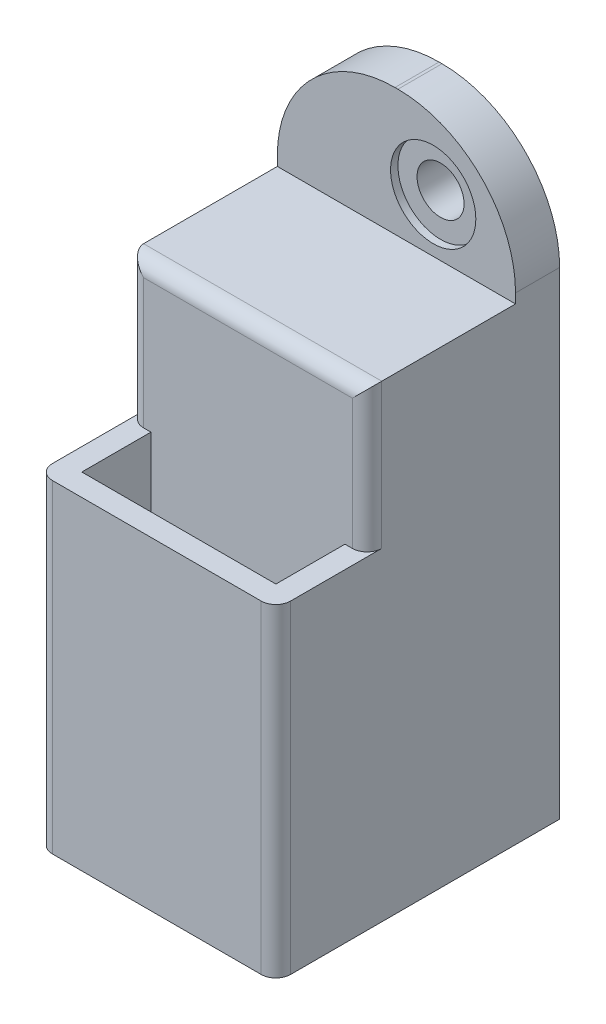
from build123d import *

# Parameters (mm, degrees)
CROQUIS2_W               = 16.2
CROQUIS2_H               = 9.2
CROQUIS2_W_2             = 13.2
CROQUIS2_H_2             = 6.2
SALIENTE_EXTRUIR1_DEPTH  = 6.5
CROQUIS3_W               = 16.2
CROQUIS3_H               = 12
SALIENTE_EXTRUIR2_DEPTH  = 2
SALIENTE_EXTRUIR3_DEPTH  = 8.1
CROQUIS5_W               = 16.2
CROQUIS5_H               = 3
SALIENTE_EXTRUIR4_DEPTH  = 13
CROQUIS6_R               = 1.6
CORTAR_EXTRUIR1_DEPTH    = 3
CROQUIS7_W               = 16.2
CROQUIS7_H               = 2
SALIENTE_EXTRUIR5_DEPTH  = 3
CROQUIS8_R               = 2.9
CORTAR_EXTRUIR2_DEPTH    = 0.5
REDONDEO1_R              = 1
REDONDEO6_R              = 8
CROQUIS9_W               = 13.2
CROQUIS9_H               = 6.2
SALIENTE_EXTRUIR6_DEPTH  = 3.5
CROQUIS10_W              = 13.2
CROQUIS10_H              = 1.5
SALIENTE_EXTRUIR7_DEPTH  = 3.5
CROQUIS11_W              = 13.2
CROQUIS11_H              = 6.2
SALIENTE_EXTRUIR8_DEPTH  = 12
CROQUIS12_W              = 13.2
CROQUIS12_H              = 1.5
SALIENTE_EXTRUIR9_DEPTH  = 12
CROQUIS13_W              = 16.2
CROQUIS13_H              = 7.85
SALIENTE_EXTRUIR10_DEPTH = 10.1
CROQUIS14_W              = 12.6
CROQUIS14_H              = 6.5
CORTAR_EXTRUIR3_DEPTH    = 8.1
REDONDEO7_R              = 1


with BuildPart() as part:
    # Croquis2 → Saliente-Extruir1 (new body)
    with BuildSketch(Plane(origin=(0, 0, 0), x_dir=(1, 0, 0), z_dir=(0, 1, 0))):
        with Locations((6.6, -3.1)):
            Rectangle(CROQUIS2_W, CROQUIS2_H)
        with Locations((6.6, -3.1)):
            Rectangle(CROQUIS2_W_2, CROQUIS2_H_2, mode=Mode.SUBTRACT)
    extrude(amount=SALIENTE_EXTRUIR1_DEPTH)

    # Croquis3 → Saliente-Extruir2 (add)
    with BuildSketch(Plane(origin=(0, 0, -1.5), x_dir=(-1, 0, 0), z_dir=(0, 0, -1))):
        with Locations((-6.6, 6)):
            Rectangle(CROQUIS3_W, CROQUIS3_H)
    extrude(amount=SALIENTE_EXTRUIR2_DEPTH)

    # Croquis4 → Saliente-Extruir3 (add)
    with BuildSketch(Plane(origin=(0, 0, -3.5), x_dir=(-1, 0, 0), z_dir=(0, 0, -1))):
        Polygon((1.5, 0), (1.5, 12), (-14.7, 12), (-14.7, 0), (-12.9, 0), (-12.9, 11), (-0.3, 11), (-0.3, 0), align=None)
    extrude(amount=SALIENTE_EXTRUIR3_DEPTH)

    # Croquis5 → Saliente-Extruir4 (add)
    with BuildSketch(Plane(origin=(0, 12, 0), x_dir=(1, 0, 0), z_dir=(0, 1, 0))):
        with Locations((6.6, 10.1)):
            Rectangle(CROQUIS5_W, CROQUIS5_H)
    extrude(amount=SALIENTE_EXTRUIR4_DEPTH)

    # Croquis6 → Cortar-Extruir1 (cut)
    with BuildSketch(Plane.XY.offset(-8.6)):
        with Locations((9.1, 20)):
            Circle(CROQUIS6_R)
    extrude(amount=-CORTAR_EXTRUIR1_DEPTH, mode=Mode.SUBTRACT)

    # Croquis7 → Saliente-Extruir5 (add)
    with BuildSketch(Plane.XY.offset(-1.5)):
        with Locations((6.6, 7.5)):
            Rectangle(CROQUIS7_W, CROQUIS7_H)
    extrude(amount=SALIENTE_EXTRUIR5_DEPTH)

    # Croquis8 → Cortar-Extruir2 (cut)
    with BuildSketch(Plane.XY.offset(-8.6)):
        with Locations((9.1, 20)):
            Circle(CROQUIS8_R)
    extrude(amount=-CORTAR_EXTRUIR2_DEPTH, mode=Mode.SUBTRACT)

    # Redondeo1
    redondeo1_edges = [part.edges().sort_by_distance(p)[0] for p in [
        (14.7, 3.25, 7.7),
        (-1.5, 3.25, 7.7),
    ]]
    fillet(redondeo1_edges, radius=REDONDEO1_R)

    # Redondeo6
    redondeo6_edges = [part.edges().sort_by_distance(p)[0] for p in [
        (14.7, 25, -10.1),
        (-1.5, 25, -10.1),
    ]]
    fillet(redondeo6_edges, radius=REDONDEO6_R)

    # Croquis9 → Saliente-Extruir6 (add)
    with BuildSketch(Plane.XZ):
        with BuildLine():
            Line((13.7, 7.7), (-0.5, 7.7))
            ThreePointArc((-0.5, 7.7), (-1.207106781, 7.407106781), (-1.5, 6.7))
            Line((-1.5, 6.7), (-1.5, -11.6))
            Line((-1.5, -11.6), (0.3, -11.6))
            Line((0.3, -11.6), (0.3, -3.5))
            Line((0.3, -3.5), (12.9, -3.5))
            Line((12.9, -3.5), (12.9, -11.6))
            Line((12.9, -11.6), (14.7, -11.6))
            Line((14.7, -11.6), (14.7, 6.7))
            ThreePointArc((14.7, 6.7), (14.407106781, 7.407106781), (13.7, 7.7))
        make_face()
        with Locations((6.6, 3.1)):
            Rectangle(CROQUIS9_W, CROQUIS9_H, mode=Mode.SUBTRACT)
    extrude(amount=SALIENTE_EXTRUIR6_DEPTH)

    # Croquis10 → Saliente-Extruir7 (add)
    with BuildSketch(Plane.XZ.offset(-6.5)):
        with Locations((6.6, 0.75)):
            Rectangle(CROQUIS10_W, CROQUIS10_H)
    extrude(amount=SALIENTE_EXTRUIR7_DEPTH)

    # Croquis11 → Saliente-Extruir8 (add)
    with BuildSketch(Plane.XZ.offset(3.5)):
        with BuildLine():
            Line((13.7, 7.7), (-0.5, 7.7))
            ThreePointArc((-0.5, 7.7), (-1.207106781, 7.407106781), (-1.5, 6.7))
            Line((-1.5, 6.7), (-1.5, -11.6))
            Line((-1.5, -11.6), (0.3, -11.6))
            Line((0.3, -11.6), (0.3, -3.5))
            Line((0.3, -3.5), (12.9, -3.5))
            Line((12.9, -3.5), (12.9, -11.6))
            Line((12.9, -11.6), (14.7, -11.6))
            Line((14.7, -11.6), (14.7, 6.7))
            ThreePointArc((14.7, 6.7), (14.407106781, 7.407106781), (13.7, 7.7))
        make_face()
        with Locations((6.6, 3.1)):
            Rectangle(CROQUIS11_W, CROQUIS11_H, mode=Mode.SUBTRACT)
    extrude(amount=SALIENTE_EXTRUIR8_DEPTH)

    # Croquis12 → Saliente-Extruir9 (add)
    with BuildSketch(Plane.XZ.offset(-3)):
        with Locations((6.6, 0.75)):
            Rectangle(CROQUIS12_W, CROQUIS12_H)
    extrude(amount=SALIENTE_EXTRUIR9_DEPTH)

    # Croquis13 → Saliente-Extruir10 (add)
    with BuildSketch(Plane.XY.offset(-8.6)):
        with Locations((6.6, 12.425)):
            Rectangle(CROQUIS13_W, CROQUIS13_H)
    extrude(amount=SALIENTE_EXTRUIR10_DEPTH)

    # Croquis14 → Cortar-Extruir3 (cut)
    with BuildSketch(Plane(origin=(0, 0, -11.6), x_dir=(-1, 0, 0), z_dir=(0, 0, -1))):
        with Locations((-6.6, 11.75)):
            Rectangle(CROQUIS14_W, CROQUIS14_H)
    extrude(amount=-CORTAR_EXTRUIR3_DEPTH, mode=Mode.SUBTRACT)

    # Redondeo7
    redondeo7_edges = [part.edges().sort_by_distance(p)[0] for p in [
        (6.6, 16.35, 1.5),
        (14.7, 11.425, 1.5),
        (-1.5, 11.425, 1.5),
    ]]
    fillet(redondeo7_edges, radius=REDONDEO7_R)


solid = part.part
